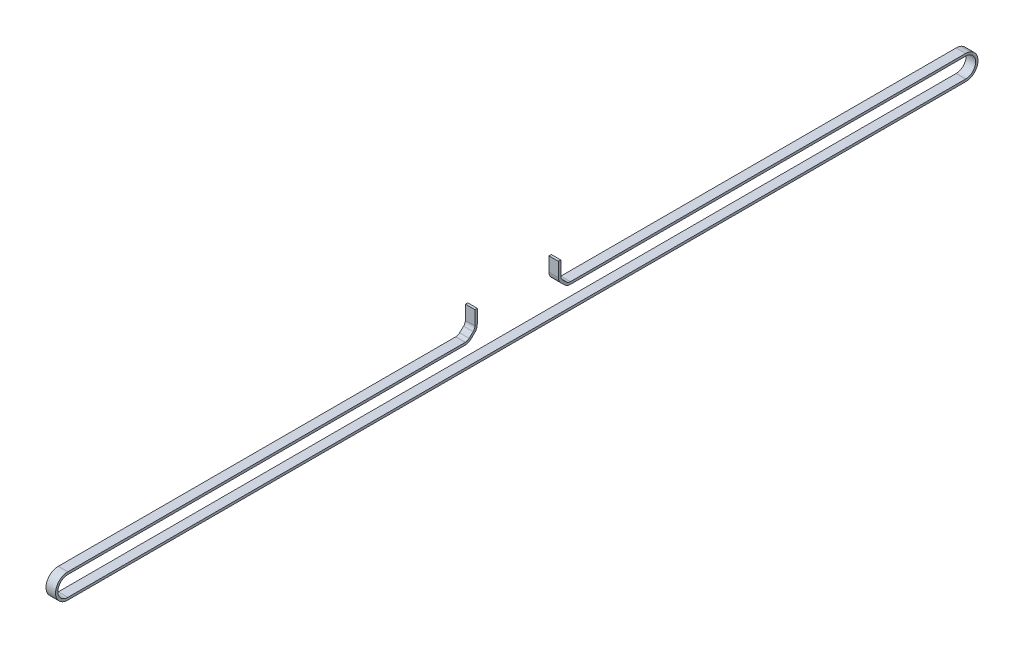
from build123d import *

# Parameters (mm, degrees)
RESSALTO_EXTRUS_O1_DEPTH = 3
BOSS_EXTRUDE1_DEPTH      = 3
CUT_EXTRUDE1_DEPTH       = 291.521948294
FILLET1_R                = 5
FILLET2_R                = 3.5


with BuildPart() as part:
    # Esboço1 → Ressalto-extrusão1 (new, symmetric)
    with BuildSketch(Plane(origin=(0, 0, 0), x_dir=(0, 0, -1), z_dir=(1, 0, 0))):
        with BuildLine():
            Line((-281.89, 7.7), (281.89, 7.7))
            ThreePointArc((281.89, 7.7), (289.59, 0), (281.89, -7.7))
            Line((281.89, -7.7), (-281.89, -7.7))
            ThreePointArc((-281.89, -7.7), (-289.59, 0), (-281.89, 7.7))
        make_face()
        with BuildLine():
            Line((-281.89, 6.2), (281.89, 6.2))
            ThreePointArc((281.89, 6.2), (288.09, 0), (281.89, -6.2))
            Line((281.89, -6.2), (-281.89, -6.2))
            ThreePointArc((-281.89, -6.2), (-288.09, 0), (-281.89, 6.2))
        make_face(mode=Mode.SUBTRACT)
    extrude(amount=RESSALTO_EXTRUS_O1_DEPTH, both=True)

    # Sketch1 → Boss-Extrude1 (add, symmetric)
    with BuildSketch(Plane(origin=(0, 0, 0), x_dir=(0, 0, -1), z_dir=(1, 0, 0))):
        Polygon((26.184631905, 14.464067762), (26.184631905, 11.464067762), (31.684631905, 6.2), (33.854011297, 6.2), (27.684631905, 12.104732939), (27.684631905, 14.464067762), (27.684631905, 22.464067762), (26.184631905, 22.464067762), align=None)
        Polygon((-24.815368095, 11.464067762), (-24.815368095, 14.464067762), (-24.815368095, 22.464067762), (-26.315368095, 22.464067762), (-26.315368095, 14.464067762), (-26.315368095, 12.104732939), (-32.484747486, 6.2), (-30.315368095, 6.2), align=None)
    extrude(amount=BOSS_EXTRUDE1_DEPTH, both=True)

    # Sketch2 → Cut-Extrude1 (cut, through all)
    with BuildSketch(Plane(origin=(3, 0, 0), x_dir=(0, 0, -1), z_dir=(1, 0, 0))):
        Polygon((-30.315368095, 6.2), (-28.748139029, 7.7), (30.117402839, 7.7), (31.684631905, 6.2), align=None)
    extrude(amount=-CUT_EXTRUDE1_DEPTH, mode=Mode.SUBTRACT)

    # Fillet1
    fillet1_edges = [part.edges().sort_by_distance(p)[0] for p in [
        (0, 11.464067762, -26.184631905),
        (0, 6.2, -31.684631905),
        (0, 6.2, 30.315368095),
        (0, 11.464067762, 24.815368095),
    ]]
    fillet(fillet1_edges, radius=FILLET1_R)

    # Fillet2
    fillet2_edges = [part.edges().sort_by_distance(p)[0] for p in [
        (0, 12.104732939, 26.315368095),
        (0, 7.7, 30.917518421),
        (0, 7.7, -32.286782231),
        (0, 12.104732939, -27.684631905),
    ]]
    fillet(fillet2_edges, radius=FILLET2_R)


solid = part.part
